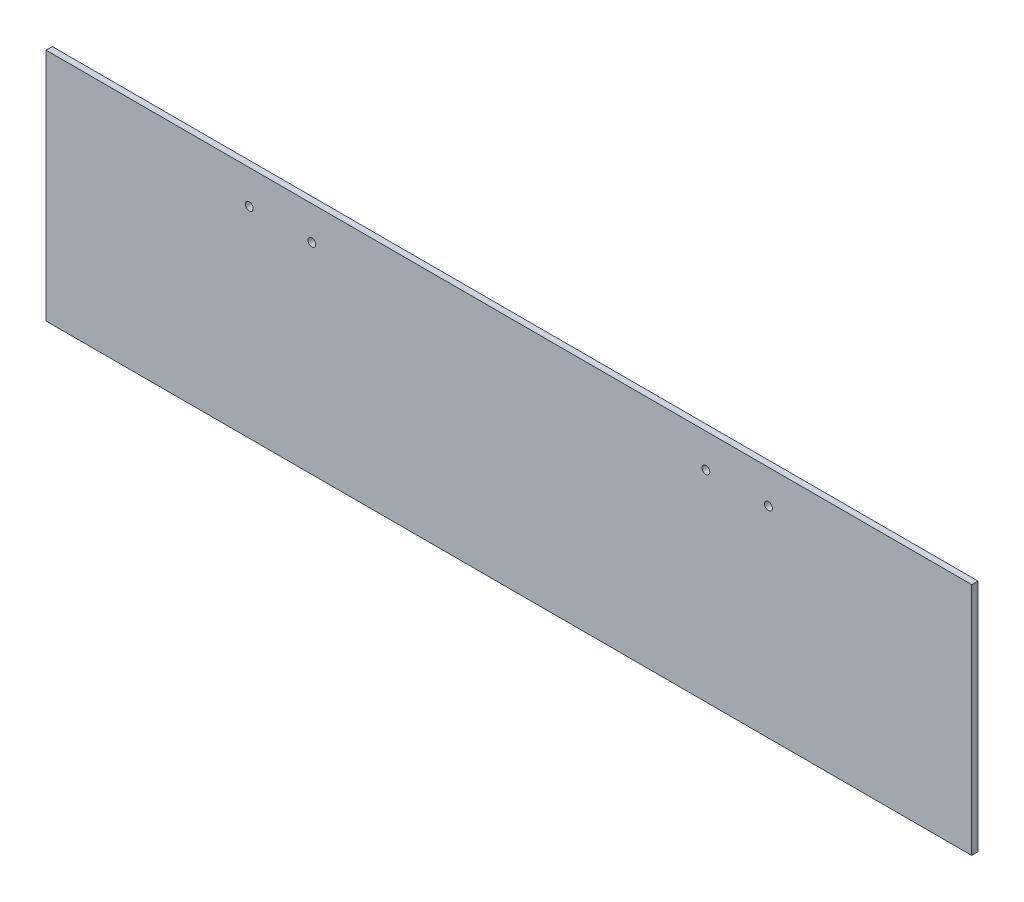
from build123d import *

# Parameters (mm, degrees)
SKETCH1_W               = 592
SKETCH1_H               = 150
BOSS_EXTRUDE1_DEPTH     = 2
TAP_DRILL_FOR_M6_TAP1_D = 5


with BuildPart() as part:
    # Sketch1 → Boss-Extrude1 (new, symmetric)
    with BuildSketch(Plane.XY):
        with Locations((0, 75)):
            Rectangle(SKETCH1_W, SKETCH1_H)
    extrude(amount=BOSS_EXTRUDE1_DEPTH, both=True)

    # Tap Drill for M6 Tap1 (through all)
    with Locations(Plane.XY.offset(2)):
        with Locations((-166, 128.5), (-126, 128.5), (126, 128.5), (166, 128.5)):
            Hole(TAP_DRILL_FOR_M6_TAP1_D / 2)


solid = part.part
